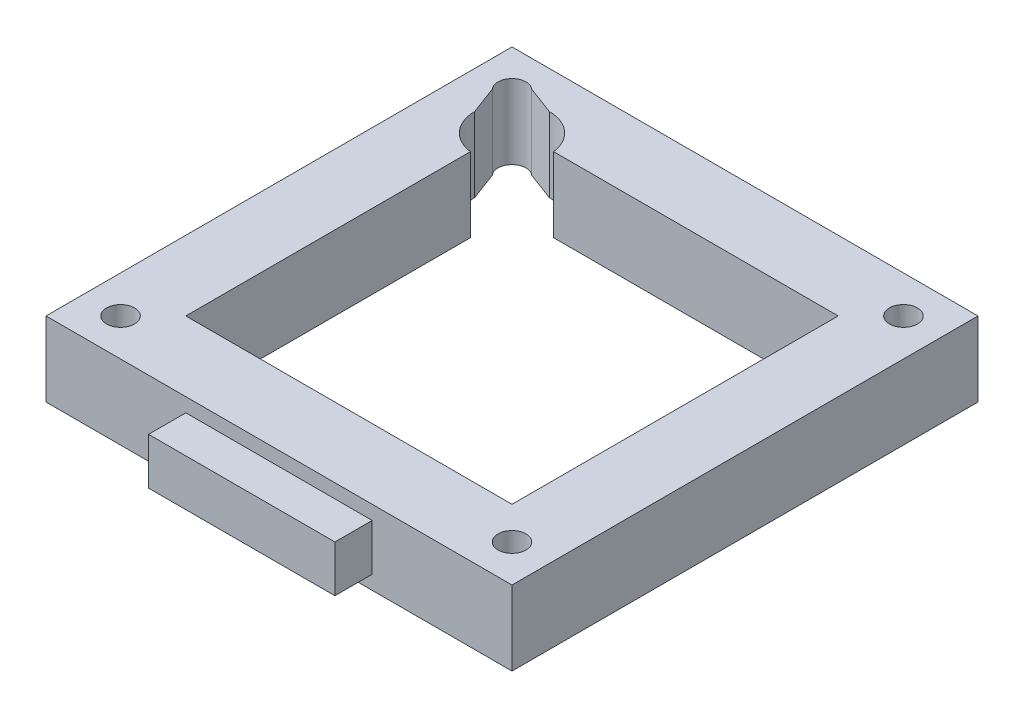
from build123d import *

# Parameters (mm, degrees)
SKETCH1_W         = 50
SKETCH1_H         = 50
SKETCH1_R         = 1.5
SUPPORT_DEPTH     = 8
SOUTH_START       = 25
SKETCH2_W         = 20
SKETCH2_H         = 5
SOUTH_DOWEL_DEPTH = 4
WEST_START        = -25
SKETCH3_W         = 20
SKETCH3_H         = 5
WEST_CUT_DEPTH    = 4


with BuildPart() as part:
    # Sketch1 → Support (new body)
    with BuildSketch(Plane(origin=(0, 0, 0), x_dir=(1, 0, 0), z_dir=(0, 1, 0))):
        Rectangle(SKETCH1_W, SKETCH1_H)
        with Locations(Location((-21, -21, 0), (0, 0, 270))):
            Circle(SKETCH1_R, mode=Mode.SUBTRACT)
        with Locations(Location((21, -21, 0), (0, 0, 270))):
            Circle(SKETCH1_R, mode=Mode.SUBTRACT)
        with BuildLine():
            Line((-13.031373033, 17.5), (17.5, 17.5))
            Line((17.5, 17.5), (17.5, -17.5))
            Line((17.5, -17.5), (-17.5, -17.5))
            Line((-17.5, -17.5), (-17.5, 13.031373033))
            ThreePointArc((-17.5, 13.031373033), (-20, 14.354248689), (-21, 17))
            Line((-21, 17), (-22.130136986, 20.01369863))
            ThreePointArc((-22.130136986, 20.01369863), (-22.060660172, 22.060660172), (-20.01369863, 22.130136986))
            Line((-20.01369863, 22.130136986), (-17, 21))
            ThreePointArc((-17, 21), (-14.354248689, 20), (-13.031373033, 17.5))
        make_face(mode=Mode.SUBTRACT)
        with Locations(Location((21, 21, 0), (0, 0, 270))):
            Circle(SKETCH1_R, mode=Mode.SUBTRACT)
    extrude(amount=SUPPORT_DEPTH)

    # Sketch2 → South Dowel (add)
    with BuildSketch(Plane.XY.offset(SOUTH_START)):
        with Locations((0, 4)):
            Rectangle(SKETCH2_W, SKETCH2_H)
    extrude(amount=SOUTH_DOWEL_DEPTH)

    # Sketch3 → West Cut (cut)
    with BuildSketch(Plane(origin=(0, 0, 0), x_dir=(0, 0, -1), z_dir=(1, 0, 0)).offset(WEST_START)):
        with Locations((0, 4)):
            Rectangle(SKETCH3_W, SKETCH3_H)
    extrude(amount=WEST_CUT_DEPTH, mode=Mode.SUBTRACT)


solid = part.part
